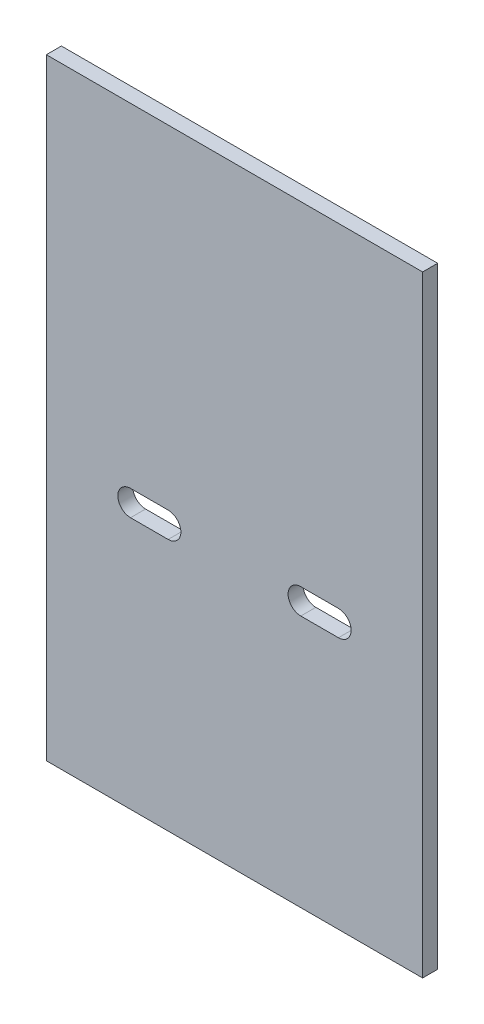
from build123d import *

# Parameters (mm, degrees)
SKETCH_1_W          = 400
SKETCH_1_H          = 650
EXTRUDE_1_DEPTH     = 16
CUT_EXTRUDE_1_DEPTH = 382.943713131


with BuildPart() as part:
    # 草图1 → 凸台-拉伸1 (new body)
    with BuildSketch(Plane.XY):
        Rectangle(SKETCH_1_W, SKETCH_1_H)
    extrude(amount=-EXTRUDE_1_DEPTH)

    # 草图2 → 切除-拉伸1 (cut, through all)
    with BuildSketch(Plane.XY):
        with BuildLine():
            Line((70.5, -29.5), (110.5, -29.5))
            ThreePointArc((110.5, -29.5), (124, -43), (110.5, -56.5))
            Line((110.5, -56.5), (70.5, -56.5))
            ThreePointArc((70.5, -56.5), (57, -43), (70.5, -29.5))
        make_face()
        with BuildLine():
            Line((-70.5, -56.5), (-110.5, -56.5))
            ThreePointArc((-110.5, -56.5), (-124, -43), (-110.5, -29.5))
            Line((-110.5, -29.5), (-70.5, -29.5))
            ThreePointArc((-70.5, -29.5), (-57, -43), (-70.5, -56.5))
        make_face()
    extrude(amount=-CUT_EXTRUDE_1_DEPTH, mode=Mode.SUBTRACT)


solid = part.part
